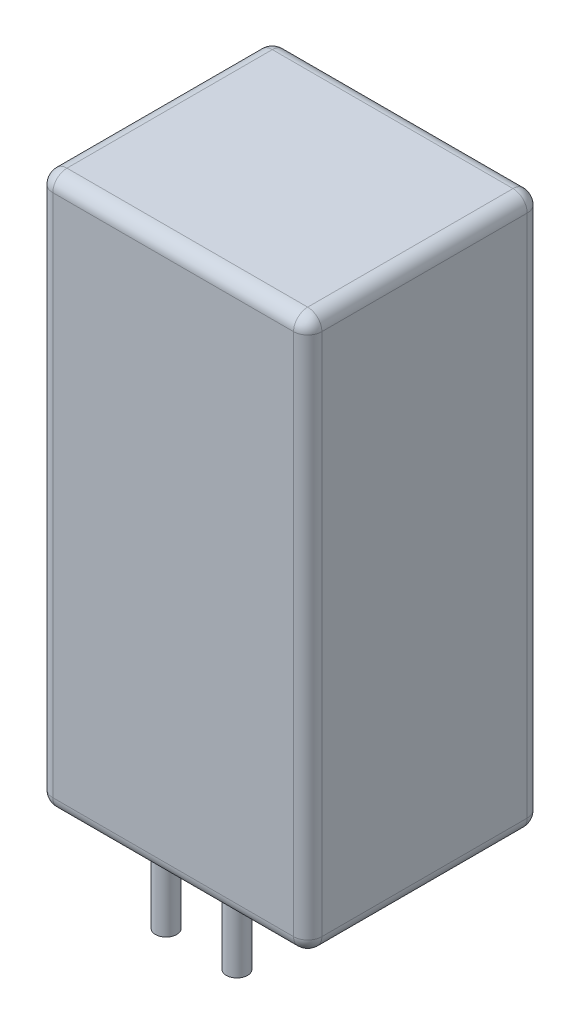
from build123d import *

# Parameters (mm, degrees)
SKETCH_1_W        = 38
SKETCH_1_H        = 33
EXTRUDE_1_DEPTH   = 78
FILLET_1_R        = 2
SKETCH_2_R        = 1.5
EXTRUDE_2_DEPTH   = 10
EXTRUDE_2_2_DEPTH = 10


with BuildPart() as part:
    # 草图1 → 凸台-拉伸1 (new body)
    with BuildSketch(Plane(origin=(0, 0, 0), x_dir=(1, 0, 0), z_dir=(0, 1, 0))):
        Rectangle(SKETCH_1_W, SKETCH_1_H)
    extrude(amount=EXTRUDE_1_DEPTH)

    # 圆角1
    fillet_1_edges = [part.edges().sort_by_distance(p)[0] for p in [
        (19, 78, 0),
        (0, 78, -16.5),
        (-19, 78, 0),
        (0, 0, -16.5),
        (19, 0, 0),
        (0, 0, 16.5),
        (-19, 0, 0),
        (-19, 39, -16.5),
        (19, 39, -16.5),
        (19, 39, 16.5),
        (-19, 39, 16.5),
        (0, 78, 16.5),
    ]]
    fillet(fillet_1_edges, radius=FILLET_1_R)


with BuildPart() as body_2:
    # 草图2 → 凸台-拉伸2 (new body)
    with BuildSketch(Plane.XZ):
        with Locations(Location((-5, 12.5, 0), (0, 0, 270))):
            Circle(SKETCH_2_R)
    extrude(amount=EXTRUDE_2_DEPTH)


with BuildPart() as body_3:
    # 草图2 → Extrude 2 2 (new body)
    with BuildSketch(Plane.XZ):
        with Locations(Location((5, 12.5, 0), (0, 0, 90))):
            Circle(SKETCH_2_R)
    extrude(amount=EXTRUDE_2_2_DEPTH)


solid = Compound([part.part, body_2.part, body_3.part])
